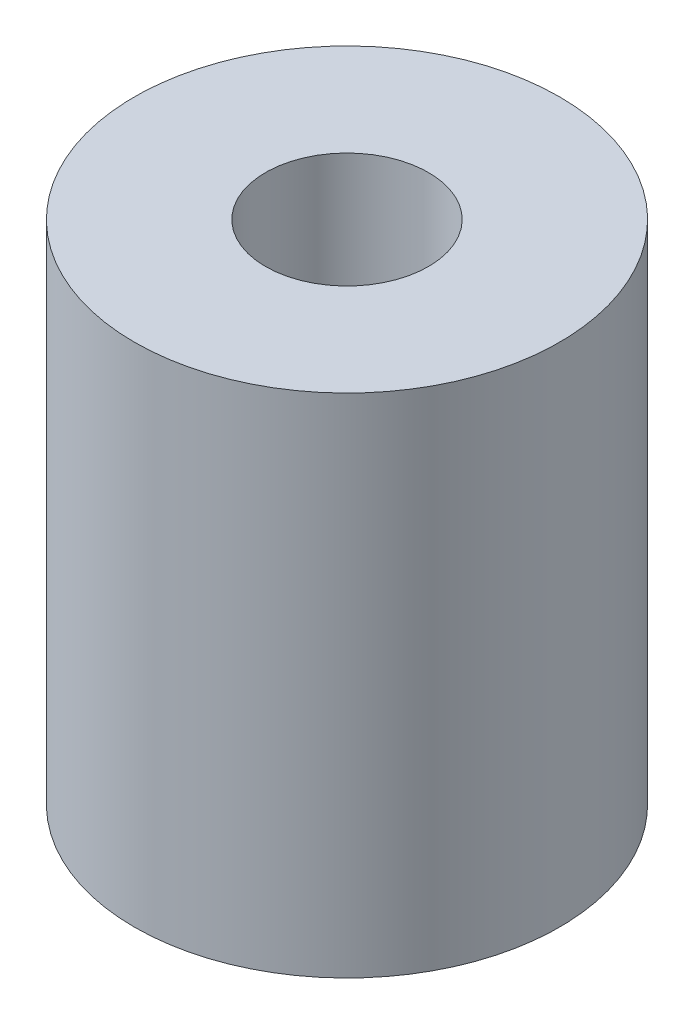
from build123d import *

# Parameters (mm, degrees)
SKETCH1_R           = 6
SKETCH1_R_2         = 2.3
BOSS_EXTRUDE1_DEPTH = 14.3


with BuildPart() as part:
    # Sketch1 → Boss-Extrude1 (new body)
    with BuildSketch(Plane(origin=(0, 0, 0), x_dir=(1, 0, 0), z_dir=(0, 1, 0))):
        with Locations(Location((0, 0, 0), (0, 0, 270))):
            Circle(SKETCH1_R)
        with Locations(Location((0, 0, 0), (0, 0, 270))):
            Circle(SKETCH1_R_2, mode=Mode.SUBTRACT)
    extrude(amount=BOSS_EXTRUDE1_DEPTH)


solid = part.part
